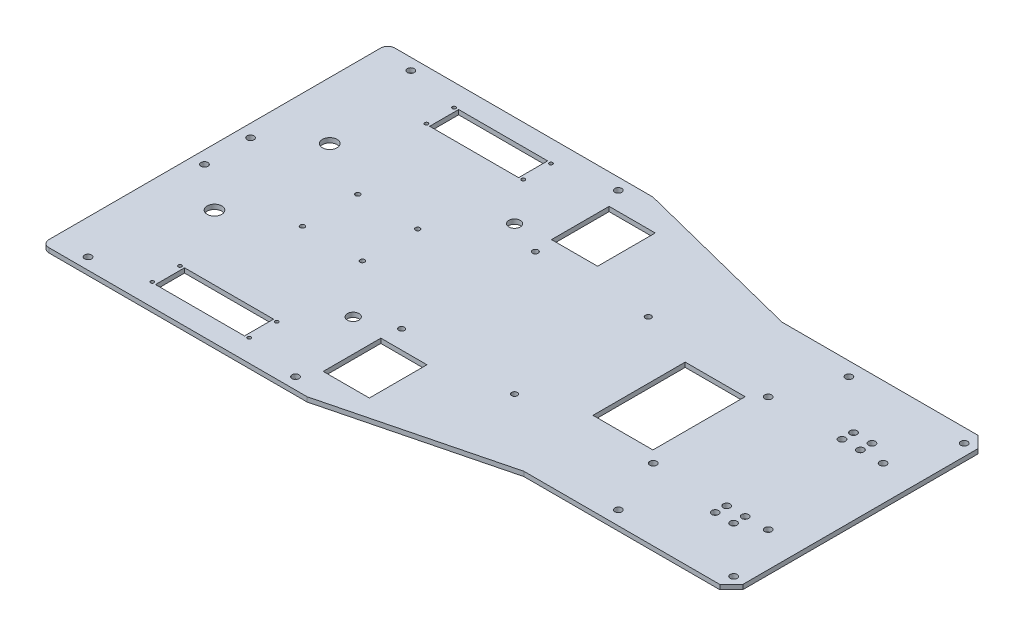
from build123d import *

# Parameters (mm, degrees)
SALIENTE_EXTRUIR1_DEPTH = 2
CROQUIS_BARRENOS_R      = 1.5
CROQUIS_BARRENOS_R_2    = 1
CROQUIS_BARRENOS_R_3    = 0.75
CROQUIS_BARRENOS_R_4    = 1.25
CROQUIS_BARRENOS_R_5    = 2.5
CROQUIS_BARRENOS_R_6    = 3.172
CROQUIS_BARRENOS_W      = 38.6
CROQUIS_BARRENOS_H      = 12.6
CROQUIS_BARRENOS_W_2    = 20
CROQUIS_BARRENOS_H_2    = 25
CROQUIS_BARRENOS_W_3    = 26
CROQUIS_BARRENOS_H_3    = 40
CORTAR_EXTRUIR1_DEPTH   = 159.836393815
REDONDEO1_R             = 3
CHAFL_N2_SIZE           = 5


with BuildPart() as part:
    # Croquis base → Saliente-Extruir1 (new body)
    with BuildSketch(Plane(origin=(0, 0, 0), x_dir=(1, 0, 0), z_dir=(0, 1, 0))):
        Polygon((-140, 75), (-25, 75), (50, 56), (140, 56), (140, -56), (50, -56), (-25, -75), (-140, -75), align=None)
    extrude(amount=SALIENTE_EXTRUIR1_DEPTH)

    # Croquis barrenos → Cortar-Extruir1 (cut, through all)
    with BuildSketch(Plane(origin=(0, 2, 0), x_dir=(1, 0, 0), z_dir=(0, 1, 0))):
        with Locations(Location((-125, -70, 0), (0, 0, 270))):
            Circle(CROQUIS_BARRENOS_R)
        with Locations(Location((-35, -70, 0), (0, 0, 270))):
            Circle(CROQUIS_BARRENOS_R)
        with Locations(Location((85, -50, 0), (0, 0, 270))):
            Circle(CROQUIS_BARRENOS_R)
        with Locations(Location((135, -50, 0), (0, 0, 270))):
            Circle(CROQUIS_BARRENOS_R)
        with Locations(Location((-134.5, -10, 0), (0, 0, 270))):
            Circle(CROQUIS_BARRENOS_R)
        with Locations(Location((-90, -12, 0), (0, 0, 270))):
            Circle(CROQUIS_BARRENOS_R_2)
        with Locations(Location((-64, -12, 0), (0, 0, 270))):
            Circle(CROQUIS_BARRENOS_R_2)
        with Locations(Location((-101.7, -53.446, 0), (0, 0, 270))):
            Circle(CROQUIS_BARRENOS_R_3)
        with Locations(Location((-101.7, -65.446, 0), (0, 0, 270))):
            Circle(CROQUIS_BARRENOS_R_3)
        with Locations(Location((-59.7, -53.446, 0), (0, 0, 270))):
            Circle(CROQUIS_BARRENOS_R_3)
        with Locations(Location((-59.7, -65.446, 0), (0, 0, 270))):
            Circle(CROQUIS_BARRENOS_R_3)
        with Locations(Location((-30, -29, 0), (0, 0, 270))):
            Circle(CROQUIS_BARRENOS_R_4)
        with Locations(Location((19, -29, 0), (0, 0, 270))):
            Circle(CROQUIS_BARRENOS_R_4)
        with Locations(Location((75.075943872, -24.926, 0), (0, 0, 270))):
            Circle(CROQUIS_BARRENOS_R)
        with Locations(Location((124.926, -24.926, 0), (0, 0, 270))):
            Circle(CROQUIS_BARRENOS_R)
        with Locations(Location((107, -25, 0), (0, 0, 270))):
            Circle(CROQUIS_BARRENOS_R)
        with Locations(Location((115, -25, 0), (0, 0, 270))):
            Circle(CROQUIS_BARRENOS_R)
        with Locations(Location((115, -30, 0), (0, 0, 270))):
            Circle(CROQUIS_BARRENOS_R)
        with Locations(Location((107, -30, 0), (0, 0, 270))):
            Circle(CROQUIS_BARRENOS_R)
        with Locations(Location((-45, -35, 0), (0, 0, 270))):
            Circle(CROQUIS_BARRENOS_R_5)
        with Locations(Location((-115.161, -25, 0), (0, 0, 270))):
            Circle(CROQUIS_BARRENOS_R_6)
        with Locations(Location((135, 50, 0), (0, 0, 90))):
            Circle(CROQUIS_BARRENOS_R)
        with Locations(Location((85, 50, 0), (0, 0, 90))):
            Circle(CROQUIS_BARRENOS_R)
        with Locations(Location((124.926, 24.926, 0), (0, 0, 90))):
            Circle(CROQUIS_BARRENOS_R)
        with Locations(Location((115, 30, 0), (0, 0, 90))):
            Circle(CROQUIS_BARRENOS_R)
        with Locations(Location((115, 25, 0), (0, 0, 90))):
            Circle(CROQUIS_BARRENOS_R)
        with Locations(Location((107, 25, 0), (0, 0, 90))):
            Circle(CROQUIS_BARRENOS_R)
        with Locations(Location((107, 30, 0), (0, 0, 90))):
            Circle(CROQUIS_BARRENOS_R)
        with Locations(Location((75.075943872, 24.926, 0), (0, 0, 90))):
            Circle(CROQUIS_BARRENOS_R)
        with Locations(Location((-90, 12, 0), (0, 0, 90))):
            Circle(CROQUIS_BARRENOS_R_2)
        with Locations(Location((-59.7, 65.446, 0), (0, 0, 90))):
            Circle(CROQUIS_BARRENOS_R_3)
        with Locations(Location((-59.7, 53.446, 0), (0, 0, 90))):
            Circle(CROQUIS_BARRENOS_R_3)
        with Locations(Location((-101.7, 53.446, 0), (0, 0, 90))):
            Circle(CROQUIS_BARRENOS_R_3)
        with Locations(Location((-101.7, 65.446, 0), (0, 0, 90))):
            Circle(CROQUIS_BARRENOS_R_3)
        with Locations(Location((19, 29, 0), (0, 0, 90))):
            Circle(CROQUIS_BARRENOS_R_4)
        with Locations(Location((-30, 29, 0), (0, 0, 90))):
            Circle(CROQUIS_BARRENOS_R_4)
        with Locations(Location((-64, 12, 0), (0, 0, 90))):
            Circle(CROQUIS_BARRENOS_R_2)
        with Locations(Location((-45, 35, 0), (0, 0, 90))):
            Circle(CROQUIS_BARRENOS_R_5)
        with Locations(Location((-35, 70, 0), (0, 0, 90))):
            Circle(CROQUIS_BARRENOS_R)
        with Locations(Location((-125, 70, 0), (0, 0, 90))):
            Circle(CROQUIS_BARRENOS_R)
        with Locations(Location((-115.161, 25, 0), (0, 0, 90))):
            Circle(CROQUIS_BARRENOS_R_6)
        with Locations(Location((-134.5, 10, 0), (0, 0, 90))):
            Circle(CROQUIS_BARRENOS_R)
        with Locations((-80.7, -59.446)):
            Rectangle(CROQUIS_BARRENOS_W, CROQUIS_BARRENOS_H)
        with Locations((-21, -49.5)):
            Rectangle(CROQUIS_BARRENOS_W_2, CROQUIS_BARRENOS_H_2)
        with Locations((57, 0)):
            Rectangle(CROQUIS_BARRENOS_W_3, CROQUIS_BARRENOS_H_3)
        with Locations((-80.7, 59.446)):
            Rectangle(CROQUIS_BARRENOS_W, CROQUIS_BARRENOS_H)
        with Locations((-21, 49.5)):
            Rectangle(CROQUIS_BARRENOS_W_2, CROQUIS_BARRENOS_H_2)
    extrude(amount=-CORTAR_EXTRUIR1_DEPTH, mode=Mode.SUBTRACT)

    # Redondeo1
    redondeo1_edges = [part.edges().sort_by_distance(p)[0] for p in [
        (-140, 1, -75),
        (-140, 1, 75),
    ]]
    fillet(redondeo1_edges, radius=REDONDEO1_R)

    # Chaflán2
    chafl_n2_edges = [part.edges().sort_by_distance(p)[0] for p in [
        (140, 1, -56),
        (140, 1, 56),
    ]]
    chamfer(chafl_n2_edges, length=CHAFL_N2_SIZE)


solid = part.part
